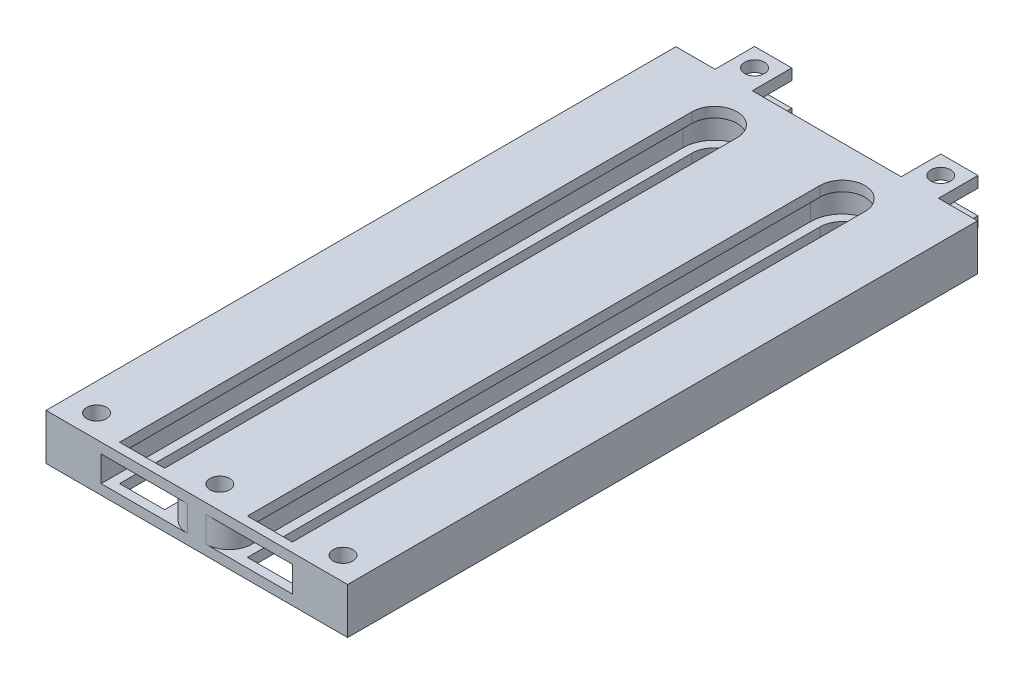
from build123d import *

# Parameters (mm, degrees)
BOSS_EXTRUDE1_DEPTH      = 5
BOSS_EXTRUDE1_DEPTH_BACK = 5
SKETCH1_W                = 32.8
SKETCH1_H                = 137
CUT_EXTRUDE1_DEPTH       = 2.8
CUT_EXTRUDE1_DEPTH_BACK  = 2.8
SKETCH1_4_R              = 4.9
CUT_EXTRUDE3_DEPTH       = 2.8
CUT_EXTRUDE3_DEPTH_BACK  = 2.8
SKETCH1_8_W              = 2
SKETCH1_8_H              = 2
SKETCH1_8_W_2            = 9.8
BOSS_EXTRUDE2_START      = 2.6
SKETCH1_5_W              = 8.1
SKETCH1_5_H              = 8.6
SKETCH1_5_R              = 2.15
BOSS_EXTRUDE2_DEPTH      = 2.4
BOSS_EXTRUDE3_START      = -5
SKETCH1_6_W              = 8.1
SKETCH1_6_H              = 8.6
SKETCH1_6_R              = 2.15
BOSS_EXTRUDE3_DEPTH      = 2.4
FILLET1_R                = 5
CUT_EXTRUDE4_DEPTH       = 141.960419977
CUT_EXTRUDE4_DEPTH_BACK  = 141.960419977
SKETCH3_R                = 2.15


with BuildPart() as part:
    # Sketch1 → Boss-Extrude1 (new, two sides: drawn at the far end of the back side and taken through both)
    with BuildSketch(Plane(origin=(0, 0, 0), x_dir=(1, 0, 0), z_dir=(0, 1, 0)).offset(-BOSS_EXTRUDE1_DEPTH_BACK)):
        with Locations((16.4, -68.5)):
            Rectangle(SKETCH1_W, SKETCH1_H)
        with BuildLine():
            Line((9, -135), (9, -10.5))
            ThreePointArc((9, -10.5), (13.9, -5.6), (18.8, -10.5))
            Line((18.8, -10.5), (18.8, -135))
            Line((18.8, -135), (9, -135))
        make_face(mode=Mode.SUBTRACT)
    extrude(amount=BOSS_EXTRUDE1_DEPTH + BOSS_EXTRUDE1_DEPTH_BACK)

    # Sketch1<4> → Cut-Extrude1 (cut, two sides: drawn at the far end of the back side and taken through both)
    with BuildSketch(Plane(origin=(0, 0, 0), x_dir=(1, 0, 0), z_dir=(0, 1, 0)).offset(-CUT_EXTRUDE1_DEPTH_BACK)):
        with BuildLine():
            Line((7, -10.5), (7, -135))
            Line((7, -135), (9, -135))
            Line((9, -135), (9, -15.357983121))
            ThreePointArc((9, -15.357983121), (7.519561144, -13.126785107), (7, -10.5))
        make_face()
        with BuildLine():
            Line((18.8, -135), (20.8, -135))
            Line((20.8, -135), (20.8, -10.5))
            ThreePointArc((20.8, -10.5), (20.280438856, -13.126785107), (18.8, -15.357983121))
            Line((18.8, -15.357983121), (18.8, -135))
        make_face()
        with BuildLine():
            Line((9, -15.357983121), (9, -135))
            Line((9, -135), (18.8, -135))
            Line((18.8, -135), (18.8, -15.357983121))
            ThreePointArc((18.8, -15.357983121), (13.9, -17.4), (9, -15.357983121))
        make_face()
        with BuildLine():
            ThreePointArc((20.8, -10.5), (13.9, -3.6), (7, -10.5))
            ThreePointArc((7, -10.5), (7.519561144, -13.126785107), (9, -15.357983121))
            Line((9, -15.357983121), (9, -10.5))
            ThreePointArc((9, -10.5), (13.9, -5.6), (18.8, -10.5))
            Line((18.8, -10.5), (18.8, -15.357983121))
            ThreePointArc((18.8, -15.357983121), (20.280438856, -13.126785107), (20.8, -10.5))
        make_face()
        with BuildLine():
            Line((9, -10.5), (9, -15.357983121))
            ThreePointArc((9, -15.357983121), (13.9, -17.4), (18.8, -15.357983121))
            Line((18.8, -15.357983121), (18.8, -10.5))
            ThreePointArc((18.8, -10.5), (13.9, -15.4), (9, -10.5))
        make_face()
        with Locations((13.9, -10.5)):
            Circle(SKETCH1_4_R)
    extrude(amount=CUT_EXTRUDE1_DEPTH + CUT_EXTRUDE1_DEPTH_BACK, mode=Mode.SUBTRACT)

    # Sketch1<8> → Cut-Extrude3 (cut, two sides: drawn at the far end of the back side and taken through both)
    with BuildSketch(Plane(origin=(0, 0, 0), x_dir=(1, 0, 0), z_dir=(0, 1, 0)).offset(-CUT_EXTRUDE3_DEPTH_BACK)):
        with Locations((8, -136)):
            Rectangle(SKETCH1_8_W, SKETCH1_8_H)
        with Locations((19.8, -136)):
            Rectangle(SKETCH1_8_W, SKETCH1_8_H)
        with Locations((13.9, -136)):
            Rectangle(SKETCH1_8_W_2, SKETCH1_8_H)
    extrude(amount=CUT_EXTRUDE3_DEPTH + CUT_EXTRUDE3_DEPTH_BACK, mode=Mode.SUBTRACT)

    # Sketch1<5> → Boss-Extrude2 (add)
    with BuildSketch(Plane(origin=(0, 0, 0), x_dir=(1, 0, 0), z_dir=(0, 1, 0)).offset(BOSS_EXTRUDE2_START)):
        with Locations((20.25, 4.3)):
            Rectangle(SKETCH1_5_W, SKETCH1_5_H)
        with Locations(Location((20.25, 4.55, 0), (0, 0, 270))):
            Circle(SKETCH1_5_R, mode=Mode.SUBTRACT)
    extrude(amount=BOSS_EXTRUDE2_DEPTH)

    # Sketch1<6> → Boss-Extrude3 (add)
    with BuildSketch(Plane(origin=(0, 0, 0), x_dir=(1, 0, 0), z_dir=(0, 1, 0)).offset(BOSS_EXTRUDE3_START)):
        with Locations((20.25, 4.3)):
            Rectangle(SKETCH1_6_W, SKETCH1_6_H)
        with Locations(Location((20.25, 4.55, 0), (0, 0, 270))):
            Circle(SKETCH1_6_R, mode=Mode.SUBTRACT)
    extrude(amount=BOSS_EXTRUDE3_DEPTH)

    # Mirror1: part across plane


with BuildPart() as part_1:
    add(part.part)
    add(part.part.mirror(Plane(origin=(0, 0, 0), x_dir=(0, 0, 1), z_dir=(1, 0, 0))))

    # Fillet1
    fillet1_edges = [part_1.edges().sort_by_distance(p)[0] for p in [
        (-7, 0, 137),
        (7, 0, 137),
    ]]
    fillet(fillet1_edges, radius=FILLET1_R)

    # Sketch3 → Cut-Extrude4 (cut, two sides: drawn at the far end of the back side and taken through both)
    with BuildSketch(Plane(origin=(0, 0, 0), x_dir=(1, 0, 0), z_dir=(0, 1, 0)).offset(-CUT_EXTRUDE4_DEPTH_BACK)):
        with Locations(Location((0, -132, 0), (0, 0, 270))):
            Circle(SKETCH3_R)
        with Locations(Location((26.8, -132, 0), (0, 0, 270))):
            Circle(SKETCH3_R)
        with Locations(Location((-26.8, -132, 0), (0, 0, 270))):
            Circle(SKETCH3_R)
    extrude(amount=CUT_EXTRUDE4_DEPTH + CUT_EXTRUDE4_DEPTH_BACK, mode=Mode.SUBTRACT)


solid = part_1.part
